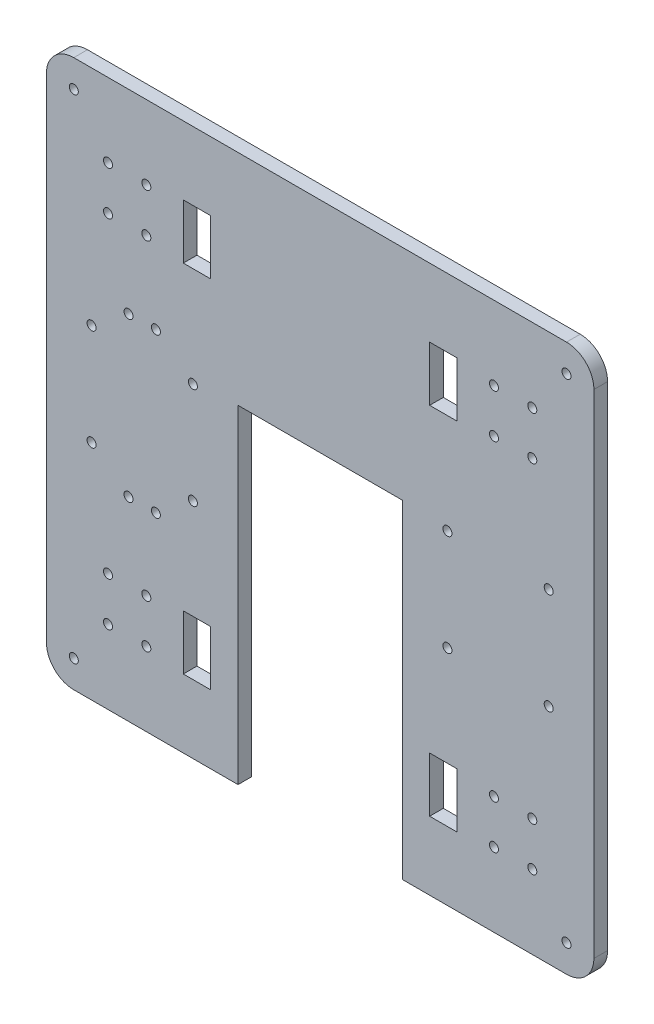
from build123d import *

# Parameters (mm, degrees)
MODEL_R         = 1.65
EXTRUDE_1_DEPTH = 5


with BuildPart() as part:
    # Model → 凸台-拉伸1 (new body)
    with BuildSketch(Plane.XY):
        with BuildLine():
            Line((197.712050333, 317.514034213), (377.712050333, 317.514034213))
            ThreePointArc((377.712050333, 317.514034213), (384.783118145, 314.585102025), (387.712050333, 307.514034213))
            Line((387.712050333, 307.514034213), (387.712050333, 127.514034213))
            ThreePointArc((387.712050333, 127.514034213), (384.783118145, 120.442966401), (377.712050333, 117.514034213))
            Line((377.712050333, 117.514034213), (317.712050333, 117.514034213))
            Line((317.712050333, 117.514034213), (317.712050333, 237.514034213))
            Line((317.712050333, 237.514034213), (257.712050333, 237.514034213))
            Line((257.712050333, 237.514034213), (257.712050333, 117.514034213))
            Line((257.712050333, 117.514034213), (197.712050333, 117.514034213))
            ThreePointArc((197.712050333, 117.514034213), (190.640982521, 120.442966401), (187.712050333, 127.514034213))
            Line((187.712050333, 127.514034213), (187.712050333, 307.514034213))
            ThreePointArc((187.712050333, 307.514034213), (190.640982521, 314.585102025), (197.712050333, 317.514034213))
        make_face()
        with Locations((204.212050333, 236.014034213)):
            Circle(MODEL_R, mode=Mode.SUBTRACT)
        with Locations((197.712050333, 127.514034213)):
            Circle(MODEL_R, mode=Mode.SUBTRACT)
        with Locations((377.712050333, 127.514034213)):
            Circle(MODEL_R, mode=Mode.SUBTRACT)
        with Locations((197.712050333, 307.514034213)):
            Circle(MODEL_R, mode=Mode.SUBTRACT)
        with Locations((377.712050333, 307.514034213)):
            Circle(MODEL_R, mode=Mode.SUBTRACT)
        with Locations((241.212050333, 236.014034213)):
            Circle(MODEL_R, mode=Mode.SUBTRACT)
        with Locations((204.212050333, 199.014034213)):
            Circle(MODEL_R, mode=Mode.SUBTRACT)
        with Locations((241.212050333, 199.014034213)):
            Circle(MODEL_R, mode=Mode.SUBTRACT)
        with Locations((371.212050333, 236.014034213)):
            Circle(MODEL_R, mode=Mode.SUBTRACT)
        with Locations((334.212050333, 236.014034213)):
            Circle(MODEL_R, mode=Mode.SUBTRACT)
        with Locations((371.212050333, 199.014034213)):
            Circle(MODEL_R, mode=Mode.SUBTRACT)
        with Locations((334.212050333, 199.014034213)):
            Circle(MODEL_R, mode=Mode.SUBTRACT)
        with Locations((210.212050333, 290.514034213)):
            Circle(MODEL_R, mode=Mode.SUBTRACT)
        with Locations((224.212050333, 290.514034213)):
            Circle(MODEL_R, mode=Mode.SUBTRACT)
        with Locations((210.212050333, 274.514034213)):
            Circle(MODEL_R, mode=Mode.SUBTRACT)
        with Locations((224.212050333, 274.514034213)):
            Circle(MODEL_R, mode=Mode.SUBTRACT)
        with Locations((210.212050333, 144.514034213)):
            Circle(MODEL_R, mode=Mode.SUBTRACT)
        with Locations((210.212050333, 160.514034213)):
            Circle(MODEL_R, mode=Mode.SUBTRACT)
        with Locations((365.212050333, 290.514034213)):
            Circle(MODEL_R, mode=Mode.SUBTRACT)
        with Locations((351.212050333, 290.514034213)):
            Circle(MODEL_R, mode=Mode.SUBTRACT)
        with Locations((365.212050333, 274.514034213)):
            Circle(MODEL_R, mode=Mode.SUBTRACT)
        with Locations((351.212050333, 274.514034213)):
            Circle(MODEL_R, mode=Mode.SUBTRACT)
        with Locations((365.212050333, 144.514034213)):
            Circle(MODEL_R, mode=Mode.SUBTRACT)
        with Locations((365.212050333, 160.514034213)):
            Circle(MODEL_R, mode=Mode.SUBTRACT)
        with Locations((224.212050333, 144.514034213)):
            Circle(MODEL_R, mode=Mode.SUBTRACT)
        with Locations((224.212050333, 160.514034213)):
            Circle(MODEL_R, mode=Mode.SUBTRACT)
        with Locations((351.212050333, 144.514034213)):
            Circle(MODEL_R, mode=Mode.SUBTRACT)
        with Locations((351.212050333, 160.514034213)):
            Circle(MODEL_R, mode=Mode.SUBTRACT)
        with Locations((227.712050333, 246.514034213)):
            Circle(MODEL_R, mode=Mode.SUBTRACT)
        with Locations((217.712050333, 246.442167925)):
            Circle(MODEL_R, mode=Mode.SUBTRACT)
        with Locations((227.712050333, 188.514034213)):
            Circle(MODEL_R, mode=Mode.SUBTRACT)
        with Locations((217.712050333, 188.585900501)):
            Circle(MODEL_R, mode=Mode.SUBTRACT)
        Polygon((247.712050333, 142.514034213), (242.712050333, 142.514034213), (237.712050333, 142.514034213), (237.712050333, 162.514034213), (247.712050333, 162.514034213), align=None, mode=Mode.SUBTRACT)
        Polygon((327.712050333, 142.514034213), (332.712050333, 142.514034213), (337.712050333, 142.514034213), (337.712050333, 162.514034213), (327.712050333, 162.514034213), align=None, mode=Mode.SUBTRACT)
        Polygon((247.712050333, 292.514034213), (242.712050333, 292.514034213), (237.712050333, 292.514034213), (237.712050333, 272.514034213), (247.712050333, 272.514034213), align=None, mode=Mode.SUBTRACT)
        Polygon((327.712050333, 292.514034213), (332.712050333, 292.514034213), (337.712050333, 292.514034213), (337.712050333, 272.514034213), (327.712050333, 272.514034213), align=None, mode=Mode.SUBTRACT)
    extrude(amount=EXTRUDE_1_DEPTH)


solid = part.part
